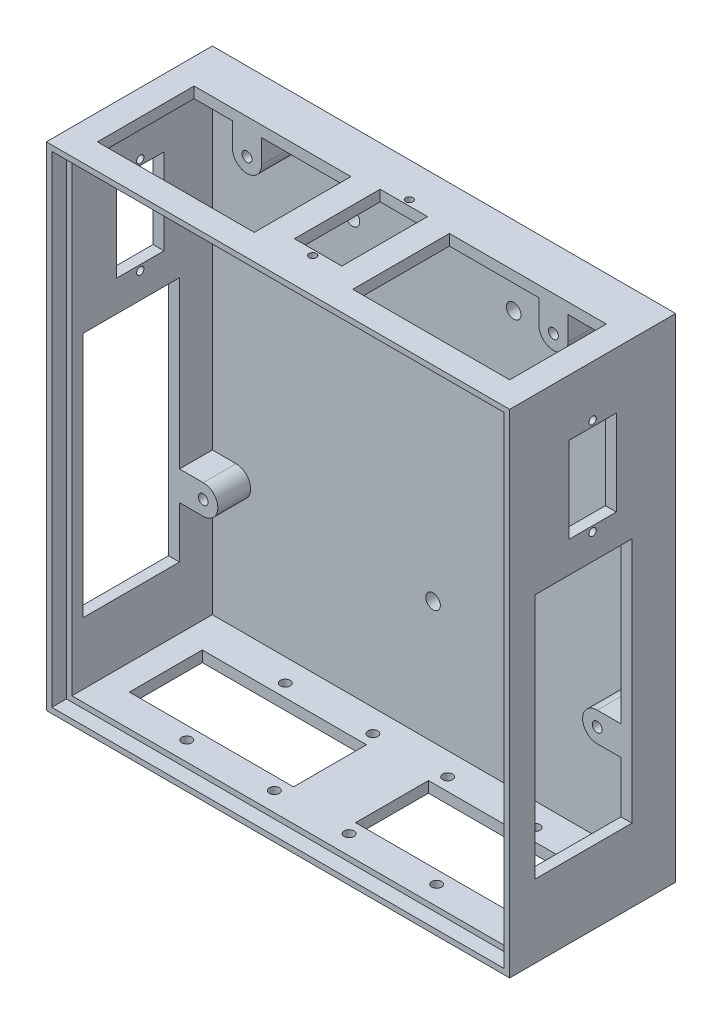
from build123d import *

# Parameters (mm, degrees)
SKETCH1_W           = 127
SKETCH1_H           = 135
BOSS_EXTRUDE1_DEPTH = 45.5
SKETCH2_W           = 121
SKETCH2_H           = 129
CUT_EXTRUDE1_DEPTH  = 42.5
SKETCH2_3_W         = 124
SKETCH2_3_H         = 132
SKETCH2_3_W_2       = 121
SKETCH2_3_H_2       = 129
CUT_EXTRUDE2_DEPTH  = 4
SKETCH3_R           = 1.35
BOSS_EXTRUDE2_DEPTH = 9
SKETCH4_R           = 1.35
BOSS_EXTRUDE3_DEPTH = 9
SKETCH5_R           = 1
SKETCH5_W           = 13
SKETCH5_H           = 23.5
CUT_EXTRUDE5_DEPTH  = 3
SKETCH7_R           = 1
SKETCH7_W           = 13
SKETCH7_H           = 23.5
CUT_EXTRUDE6_DEPTH  = 124
SKETCH8_R           = 1.35
SKETCH8_W           = 45
SKETCH8_H           = 20
CUT_EXTRUDE7_DEPTH  = 3
SKETCH9_R           = 2
CUT_EXTRUDE8_DEPTH  = 3
CUT_EXTRUDE9_REACH  = 152.849
SKETCH10_W          = 26.5
SKETCH10_H          = 67.5
SKETCH11_W          = 43
SKETCH11_H          = 26.5
CUT_EXTRUDE10_DEPTH = 3


with BuildPart() as part:
    # Sketch1 → Boss-Extrude1 (new body)
    with BuildSketch(Plane.XY):
        Rectangle(SKETCH1_W, SKETCH1_H)
    extrude(amount=BOSS_EXTRUDE1_DEPTH)

    # Sketch2 → Cut-Extrude1 (cut)
    with BuildSketch(Plane.XY.offset(45.5)):
        Rectangle(SKETCH2_W, SKETCH2_H)
    extrude(amount=-CUT_EXTRUDE1_DEPTH, mode=Mode.SUBTRACT)

    # Sketch2<3> → Cut-Extrude2 (cut)
    with BuildSketch(Plane.XY.offset(45.5)):
        Rectangle(SKETCH2_3_W, SKETCH2_3_H)
        Rectangle(SKETCH2_3_W_2, SKETCH2_3_H_2, mode=Mode.SUBTRACT)
    extrude(amount=-CUT_EXTRUDE2_DEPTH, mode=Mode.SUBTRACT)

    # Sketch3 → Boss-Extrude2 (add)
    with BuildSketch(Plane.XY.offset(3)):
        with BuildLine():
            Line((38, 64.5), (38, 58))
            ThreePointArc((38, 58), (42, 54), (46, 58))
            Line((46, 58), (46, 64.5))
            Line((46, 64.5), (38, 64.5))
        make_face()
        with Locations((42, 58)):
            Circle(SKETCH3_R, mode=Mode.SUBTRACT)
    boss_extrude2 = extrude(amount=BOSS_EXTRUDE2_DEPTH)

    # Mirror1: Boss-Extrude2 across plane
    add(boss_extrude2.mirror(Plane(origin=(0, 0, 0), x_dir=(0, 0, 1), z_dir=(1, 0, 0))))

    # Sketch4 → Boss-Extrude3 (add)
    with BuildSketch(Plane.XY.offset(3)):
        with BuildLine():
            Line((60.5, -25.4), (54, -25.4))
            ThreePointArc((54, -25.4), (50, -29.4), (54, -33.4))
            Line((54, -33.4), (60.5, -33.4))
            Line((60.5, -33.4), (60.5, -25.4))
        make_face()
        with Locations((54, -29.4)):
            Circle(SKETCH4_R, mode=Mode.SUBTRACT)
    boss_extrude3 = extrude(amount=BOSS_EXTRUDE3_DEPTH)

    # Mirror2: Boss-Extrude3 across plane
    add(boss_extrude3.mirror(Plane(origin=(0, 0, 0), x_dir=(0, 0, 1), z_dir=(1, 0, 0))))

    # Sketch5 → Cut-Extrude5 (cut)
    with BuildSketch(Plane(origin=(0, 67.5, 0), x_dir=(1, 0, 0), z_dir=(0, 1, 0))):
        with Locations(Location((0, -9.5, 0), (0, 0, 180))):
            Circle(SKETCH5_R)
        with Locations(Location((0, -36, 0), (0, 0, 270))):
            Circle(SKETCH5_R)
        with Locations((0, -22.75)):
            Rectangle(SKETCH5_W, SKETCH5_H)
    extrude(amount=-CUT_EXTRUDE5_DEPTH, mode=Mode.SUBTRACT)

    # Sketch7 → Cut-Extrude6 (cut)
    with BuildSketch(Plane(origin=(63.5, 0, 0), x_dir=(0, 0, -1), z_dir=(1, 0, 0))):
        with Locations(Location((-22.75, 53.5, 0), (0, 0, 90))):
            Circle(SKETCH7_R)
        with Locations(Location((-22.75, 27, 0), (0, 0, 90))):
            Circle(SKETCH7_R)
        with Locations((-22.75, 40.25)):
            Rectangle(SKETCH7_W, SKETCH7_H)
    cut_extrude6 = extrude(amount=-CUT_EXTRUDE6_DEPTH, mode=Mode.SUBTRACT)

    # Mirror4: Cut-Extrude6 across plane
    add(cut_extrude6.mirror(Plane(origin=(0, 0, 0), x_dir=(0, 0, 1), z_dir=(1, 0, 0))), mode=Mode.SUBTRACT)

    # Sketch8 → Cut-Extrude7 (cut)
    with BuildSketch(Plane.XZ.offset(67.5)):
        with Locations((-10.25, 36.25)):
            Circle(SKETCH8_R)
        with Locations((-34.25, 36.25)):
            Circle(SKETCH8_R)
        with Locations((-34.25, 9.25)):
            Circle(SKETCH8_R)
        with Locations((-10.25, 9.25)):
            Circle(SKETCH8_R)
        with Locations((-31, 22.75)):
            Rectangle(SKETCH8_W, SKETCH8_H)
    cut_extrude7 = extrude(amount=-CUT_EXTRUDE7_DEPTH, mode=Mode.SUBTRACT)

    # Mirror5: Cut-Extrude7 across plane
    add(cut_extrude7.mirror(Plane(origin=(0, 0, 0), x_dir=(0, 0, 1), z_dir=(1, 0, 0))), mode=Mode.SUBTRACT)

    # Sketch9 → Cut-Extrude8 (cut)
    with BuildSketch(Plane(origin=(0, 0, 0), x_dir=(-1, 0, 0), z_dir=(0, 0, -1))):
        with Locations((-22.1, 48.945)):
            Circle(SKETCH9_R)
        with Locations((0, -31.065)):
            Circle(SKETCH9_R)
    cut_extrude8 = extrude(amount=-CUT_EXTRUDE8_DEPTH, mode=Mode.SUBTRACT)

    # Mirror6: Cut-Extrude8 across plane
    add(cut_extrude8.mirror(Plane(origin=(0, 0, 0), x_dir=(0, 0, 1), z_dir=(1, 0, 0))), mode=Mode.SUBTRACT)

    # Cut-Extrude9: up to this face of the body (flat: up to its plane)
    cut_extrude9_end = Plane(part.part.faces().sort_by_distance((-63.5, -2.152269371, 22.75))[0])
    # Sketch10 → Cut-Extrude9 (cut, up to the picked face)
    with BuildSketch(Plane(origin=(63.5, 0, 0), x_dir=(0, 0, -1), z_dir=(1, 0, 0)), mode=Mode.PRIVATE) as cut_extrude9_sk1:
        with Locations((-25.25, -13.75)):
            Rectangle(SKETCH10_W, SKETCH10_H)
    cut_extrude9_tool1 = split(extrude(cut_extrude9_sk1.sketch, amount=-CUT_EXTRUDE9_REACH, mode=Mode.PRIVATE), bisect_by=cut_extrude9_end, keep=Keep.BOTH, mode=Mode.PRIVATE)
    add(cut_extrude9_tool1.solids().sort_by(Axis((63.5, -13.75, 25.25), (-1, 0, 0)))[0], mode=Mode.SUBTRACT)

    # Sketch11 → Cut-Extrude10 (cut)
    with BuildSketch(Plane(origin=(0, 67.5, 0), x_dir=(1, 0, 0), z_dir=(0, 1, 0))):
        with Locations((35, -25.25)):
            Rectangle(SKETCH11_W, SKETCH11_H)
    cut_extrude10 = extrude(amount=-CUT_EXTRUDE10_DEPTH, mode=Mode.SUBTRACT)

    # Mirror7: Cut-Extrude10 across plane
    add(cut_extrude10.mirror(Plane(origin=(0, 0, 0), x_dir=(0, 0, 1), z_dir=(1, 0, 0))), mode=Mode.SUBTRACT)


solid = part.part
